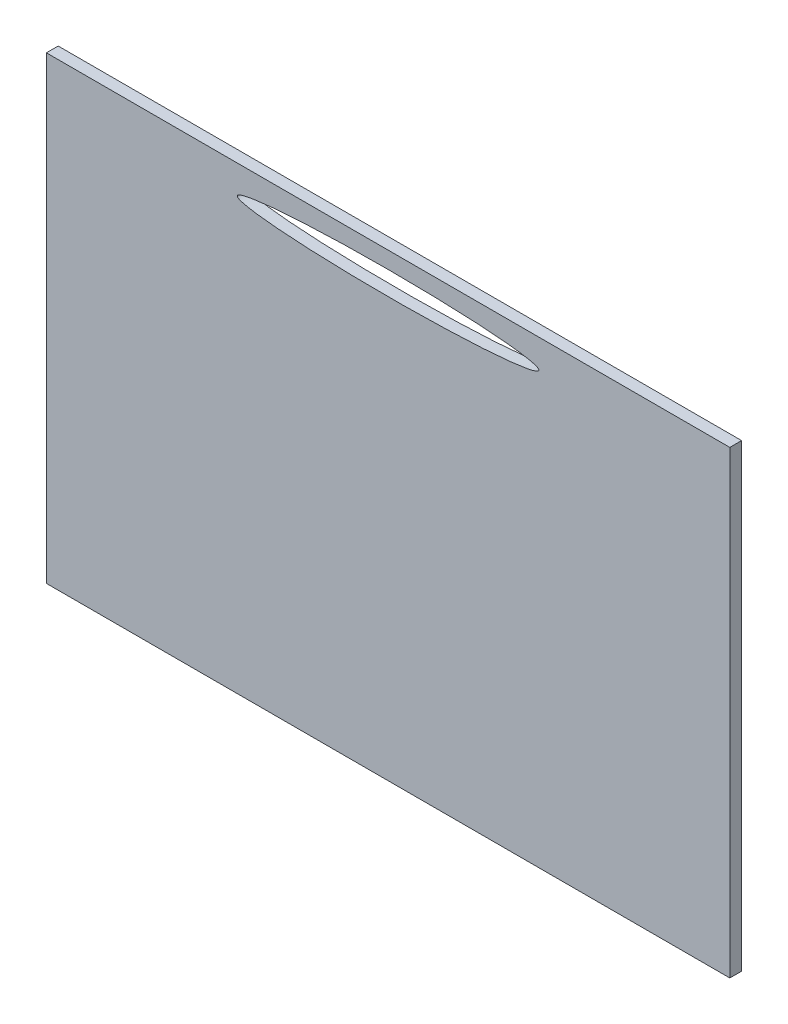
from build123d import *

# Parameters (mm, degrees)
CROQUIS1_W              = 116
CROQUIS1_H              = 78
SALIENTE_EXTRUIR1_DEPTH = 2
CORTAR_EXTRUIR1_REACH   = 100.833
CROQUIS2_RX             = 25.597751957
CROQUIS2_RY             = 2


with BuildPart() as part:
    # Croquis1 → Saliente-Extruir1 (new body)
    with BuildSketch(Plane.XY):
        with Locations((0, 41)):
            Rectangle(CROQUIS1_W, CROQUIS1_H)
    extrude(amount=SALIENTE_EXTRUIR1_DEPTH)

    # Croquis2 → Cortar-Extruir1 (cut, up to next)
    with BuildSketch(Plane.XY.offset(2), mode=Mode.PRIVATE) as cortar_extruir1_sk1:
        with Locations(Location((0, 75.153449431), (0, 0, 0))):
            Ellipse(CROQUIS2_RX, CROQUIS2_RY)
    cortar_extruir1_tool1 = extrude(cortar_extruir1_sk1.sketch, amount=-CORTAR_EXTRUIR1_REACH, mode=Mode.PRIVATE) & part.part
    add(cortar_extruir1_tool1.solids().sort_by_distance((0, 75.153449, 2))[0], mode=Mode.SUBTRACT)


solid = part.part
